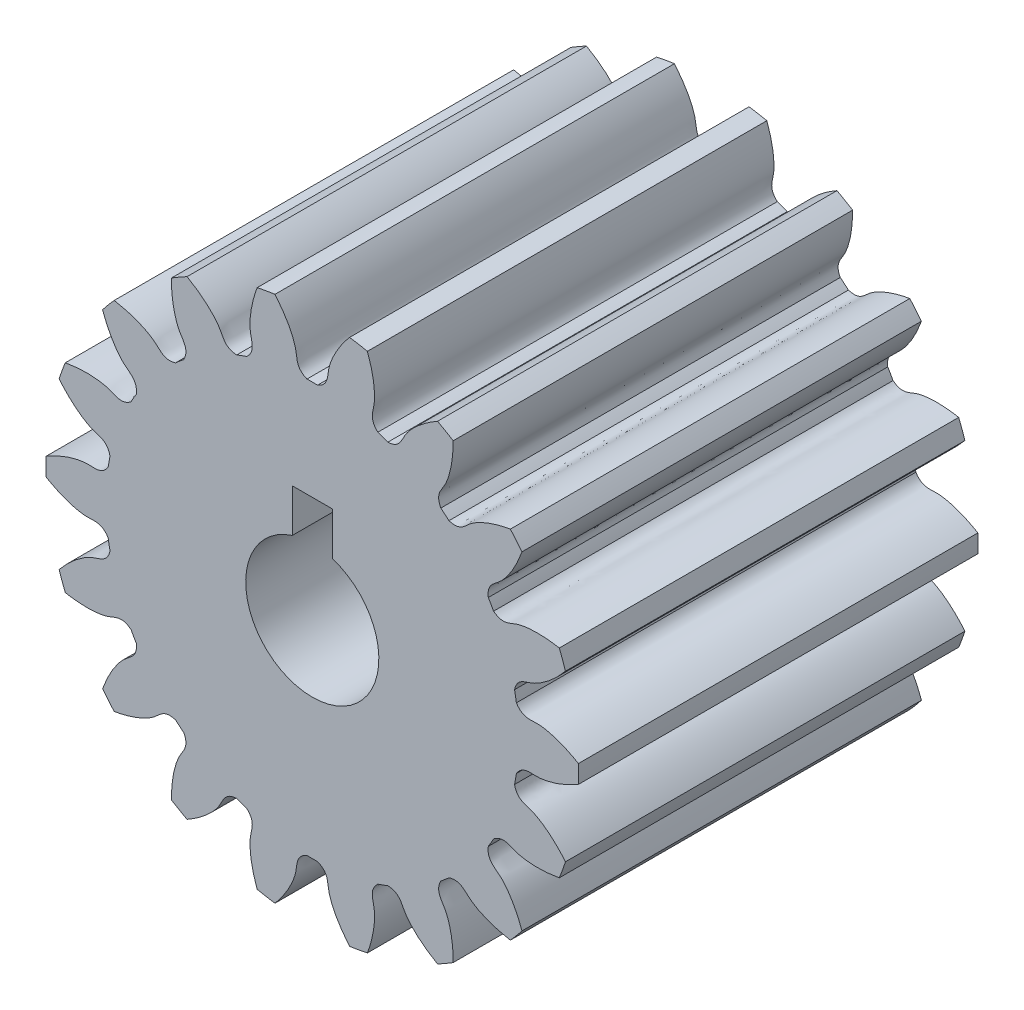
from build123d import *

# Parameters (mm, degrees)
SKETCH_1_R               = 20
EXTRUDE_1_DEPTH          = 30
CUT_EXTRUDE_1_DEPTH      = 42.231056256
PATTERN_CIRCULAR_1_COUNT = 18
CUT_EXTRUDE_2_DEPTH      = 42.135739048


with BuildPart() as part:
    # 草图1 → 凸台-拉伸1 (new body)
    with BuildSketch(Plane.XY):
        Circle(SKETCH_1_R)
    extrude(amount=EXTRUDE_1_DEPTH)

    # 草图2 → 切除-拉伸1 (cut, through all)
    with BuildSketch(Plane.XY):
        with BuildLine():
            ThreePointArc((0.398807118, 15.494868598), (0, 15.5), (-0.398807118, 15.494868598))
            add(Edge.make_bspline(
                [(-0.398807118, 15.494868598), (-1.23020808, 15.837360781), (-1.1255781, 16.477399004), (-1.263665829, 17.085190913), (-1.27750304, 17.141013201), (-1.294215187, 17.203080949), (-1.314049419, 17.271300365), (-1.337260061, 17.345568336), (-1.364095436, 17.425774664), (-1.394801707, 17.511801464), (-1.429621434, 17.603523458), (-1.46879375, 17.700807993), (-1.512554053, 17.803515157), (-1.561133842, 17.911497864), (-1.614760517, 18.02460196), (-1.673657194, 18.142666331), (-1.738042511, 18.265523008), (-1.80813045, 18.392997287), (-1.884130152, 18.524907848), (-1.96624574, 18.661066879), (-2.054676143, 18.801280205), (-2.149614924, 18.945347423), (-2.25125011, 19.09306204), (-2.359764029, 19.244211611), (-2.475333142, 19.398577891), (-2.598127894, 19.555936981), (-2.728312549, 19.716059488), (-2.866045047, 19.878710674), (-3.011476851, 20.043650629), (-3.164752807, 20.210634428), (-3.326011005, 20.379412306), (-3.495382642, 20.549729829), (-3.672991892, 20.72132807), (-3.858955782, 20.893943792), (-4.053384065, 21.067309626), (-4.256379108, 21.241154261), (-4.468035775, 21.415202635), (-4.68844132, 21.58917612), (-4.917675281, 21.762792726), (-5.155809396, 21.935767291), (-5.402907448, 22.107811691), (-5.748150706, 22.338079033), (-6.015110877, 22.504667558), (-6.197121782, 22.613356759)],
                knots=[0, 0, 0, 0, 0.187591972, 0.192996016, 0.1991206, 0.205965723, 0.213531386, 0.221817587, 0.230824328, 0.240551609, 0.250999428, 0.262167787, 0.274056685, 0.286666122, 0.299996099, 0.314046614, 0.32881767, 0.344309264, 0.360521397, 0.37745407, 0.395107283, 0.413481034, 0.432575325, 0.452390155, 0.472925524, 0.494181432, 0.51615788, 0.538854867, 0.562272393, 0.586410459, 0.611269064, 0.636848208, 0.663147891, 0.690168114, 0.717908876, 0.746370177, 0.775552017, 0.805454397, 0.836077316, 0.867420774, 0.899484772, 0.932269309, 1, 1, 1, 1], degree=3))
            ThreePointArc((-6.197121782, 22.613356759), (0, 23.447136761), (6.197121782, 22.613356759))
            add(Edge.make_bspline(
                [(0.398807118, 15.494868598), (1.23020808, 15.837360781), (1.1255781, 16.477399004), (1.263665829, 17.085190913), (1.27750304, 17.141013201), (1.294215187, 17.203080949), (1.314049419, 17.271300365), (1.337260061, 17.345568336), (1.364095436, 17.425774664), (1.394801707, 17.511801464), (1.429621434, 17.603523458), (1.46879375, 17.700807993), (1.512554053, 17.803515157), (1.561133842, 17.911497864), (1.614760517, 18.02460196), (1.673657194, 18.142666331), (1.738042511, 18.265523008), (1.80813045, 18.392997287), (1.884130152, 18.524907848), (1.96624574, 18.661066879), (2.054676143, 18.801280205), (2.149614924, 18.945347423), (2.25125011, 19.09306204), (2.359764029, 19.244211611), (2.475333142, 19.398577891), (2.598127894, 19.555936981), (2.728312549, 19.716059488), (2.866045047, 19.878710674), (3.011476851, 20.043650629), (3.164752807, 20.210634428), (3.326011005, 20.379412306), (3.495382642, 20.549729829), (3.672991892, 20.72132807), (3.858955782, 20.893943792), (4.053384065, 21.067309626), (4.256379108, 21.241154261), (4.468035775, 21.415202635), (4.68844132, 21.58917612), (4.917675281, 21.762792726), (5.155809396, 21.935767291), (5.402907448, 22.107811691), (5.748150706, 22.338079033), (6.015110877, 22.504667558), (6.197121782, 22.613356759)],
                knots=[0, 0, 0, 0, 0.187591972, 0.192996016, 0.1991206, 0.205965723, 0.213531386, 0.221817587, 0.230824328, 0.240551609, 0.250999428, 0.262167787, 0.274056685, 0.286666122, 0.299996099, 0.314046614, 0.32881767, 0.344309264, 0.360521397, 0.37745407, 0.395107283, 0.413481034, 0.432575325, 0.452390155, 0.472925524, 0.494181432, 0.51615788, 0.538854867, 0.562272393, 0.586410459, 0.611269064, 0.636848208, 0.663147891, 0.690168114, 0.717908876, 0.746370177, 0.775552017, 0.805454397, 0.836077316, 0.867420774, 0.899484772, 0.932269309, 1, 1, 1, 1], degree=3))
        make_face()
    cut_extrude_1 = extrude(amount=CUT_EXTRUDE_1_DEPTH, mode=Mode.SUBTRACT)

    # 阵列(圆周)1: 切除-拉伸1 ×18 about axis
    pattern_circular_1_axis = Axis((0, 0, -1.5), (0, 0, 1))
    for i in range(1, PATTERN_CIRCULAR_1_COUNT):
        add(cut_extrude_1.rotate(pattern_circular_1_axis, i * 360 / PATTERN_CIRCULAR_1_COUNT), mode=Mode.SUBTRACT)

    # 草图4 → 切除-拉伸2 (cut, through all)
    with BuildSketch(Plane.XY.offset(30)):
        with BuildLine():
            Line((1.5, 4.769696007), (1.5, 8))
            Line((1.5, 8), (-1.5, 8))
            Line((-1.5, 8), (-1.5, 4.769696007))
            ThreePointArc((-1.5, 4.769696007), (0, -5), (1.5, 4.769696007))
        make_face()
    extrude(amount=-CUT_EXTRUDE_2_DEPTH, mode=Mode.SUBTRACT)


solid = part.part
